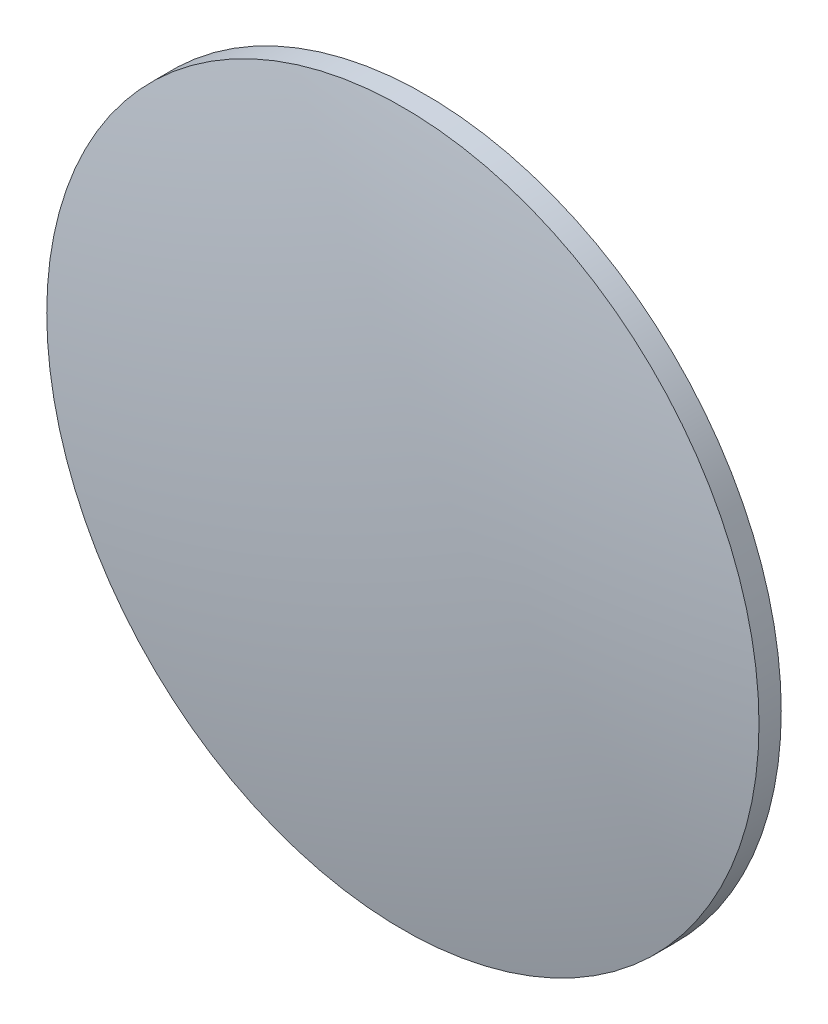
from build123d import *


with BuildPart() as part:
    # Sketch2 → Revolve1 (revolve)
    with BuildSketch(Plane(origin=(0, 0, 0), x_dir=(1, 0, 0), z_dir=(0, 1, 0)), mode=Mode.PRIVATE) as revolve1_sk:
        with BuildLine():
            Line((50.8, 0), (0, 0))
            Line((0, 0), (0, -6.35))
            ThreePointArc((0, -6.35), (25.511376904, -5.156770314), (50.8, -1.5875))
            Line((50.8, -1.5875), (50.8, 0))
        make_face()
        with BuildLine():
            Line((0, 6.35), (0, 0))
            Line((0, 0), (50.8, 0))
            Line((50.8, 0), (50.8, 1.5875))
            ThreePointArc((50.8, 1.5875), (25.511376904, 5.156770314), (0, 6.35))
        make_face()
    revolve(revolve1_sk.sketch.rotate(Axis((0, 0, 6.35), (0, 0, -1)), 180), axis=Axis((0, 0, 6.35), (0, 0, -1)))


solid = part.part
